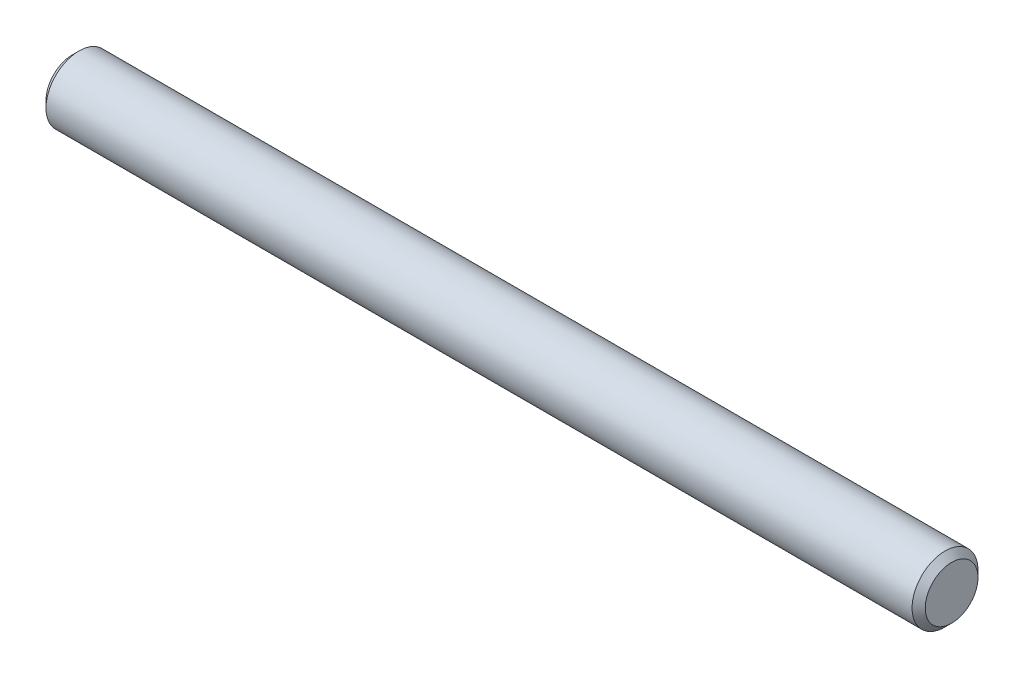
from build123d import *

# Parameters (mm, degrees)
SKETCH_1_R      = 1.5
EXTRUDE_1_DEPTH = 20
CHAMFER_1_SIZE  = 0.3


with BuildPart() as part:
    # 草图1 → 凸台-拉伸1 (new, symmetric)
    with BuildSketch(Plane(origin=(0, 0, 0), x_dir=(0, 0, -1), z_dir=(1, 0, 0))):
        Circle(SKETCH_1_R)
    extrude(amount=EXTRUDE_1_DEPTH, both=True)

    # 倒角1
    chamfer_1_edges = [part.edges().sort_by_distance(p)[0] for p in [
        (-20, 0, 1.5),
        (20, 0, 1.5),
    ]]
    chamfer(chamfer_1_edges, length=CHAMFER_1_SIZE)


solid = part.part
